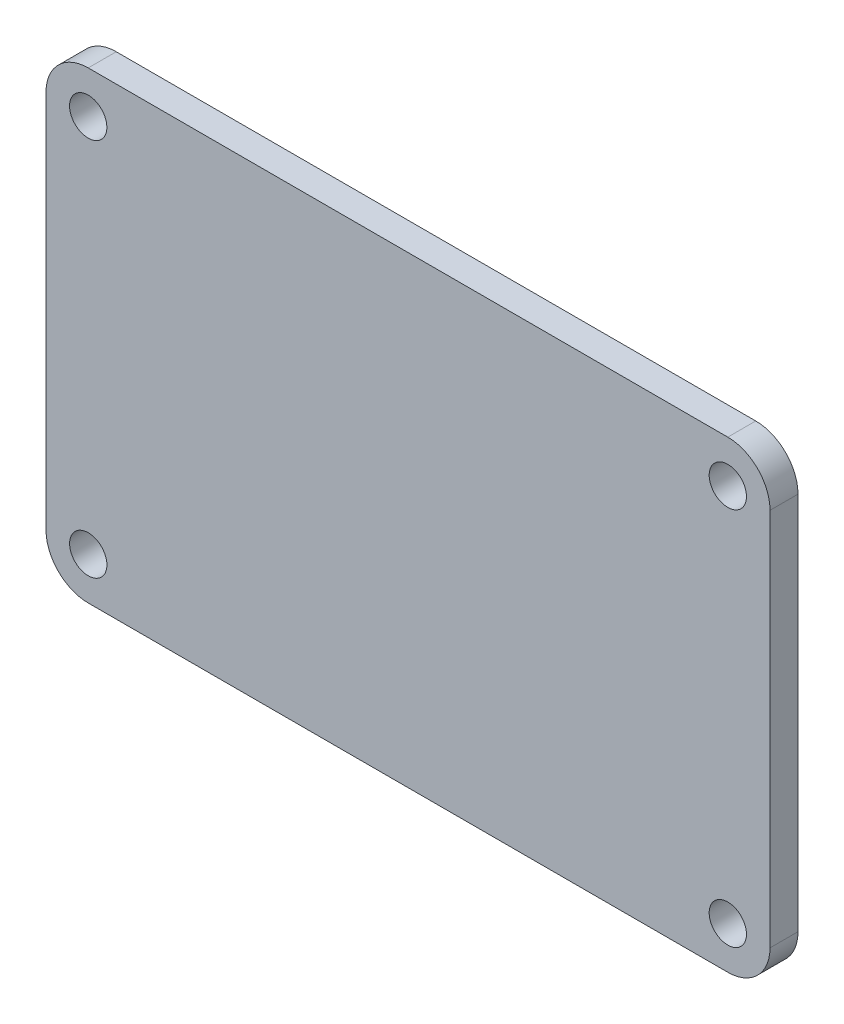
from build123d import *

# Parameters (mm, degrees)
SKETCH_1_R      = 2
EXTRUDE_1_DEPTH = 1.5


with BuildPart() as part:
    # 草图1 → 凸台-拉伸1 (new, symmetric)
    with BuildSketch(Plane.XY):
        with BuildLine():
            Line((-34.285, 24.845), (34.285, 24.845))
            ThreePointArc((34.285, 24.845), (37.488193719, 23.518193719), (38.815, 20.315))
            Line((38.815, 20.315), (38.815, -20.315))
            ThreePointArc((38.815, -20.315), (37.488193719, -23.518193719), (34.285, -24.845))
            Line((34.285, -24.845), (-34.285, -24.845))
            ThreePointArc((-34.285, -24.845), (-37.488193719, -23.518193719), (-38.815, -20.315))
            Line((-38.815, -20.315), (-38.815, 20.315))
            ThreePointArc((-38.815, 20.315), (-37.488193719, 23.518193719), (-34.285, 24.845))
        make_face()
        with Locations((34.29, 20.32)):
            Circle(SKETCH_1_R, mode=Mode.SUBTRACT)
        with Locations((34.29, -20.32)):
            Circle(SKETCH_1_R, mode=Mode.SUBTRACT)
        with Locations((-34.29, 20.32)):
            Circle(SKETCH_1_R, mode=Mode.SUBTRACT)
        with Locations((-34.285, -20.315)):
            Circle(SKETCH_1_R, mode=Mode.SUBTRACT)
    extrude(amount=EXTRUDE_1_DEPTH, both=True)


solid = part.part
